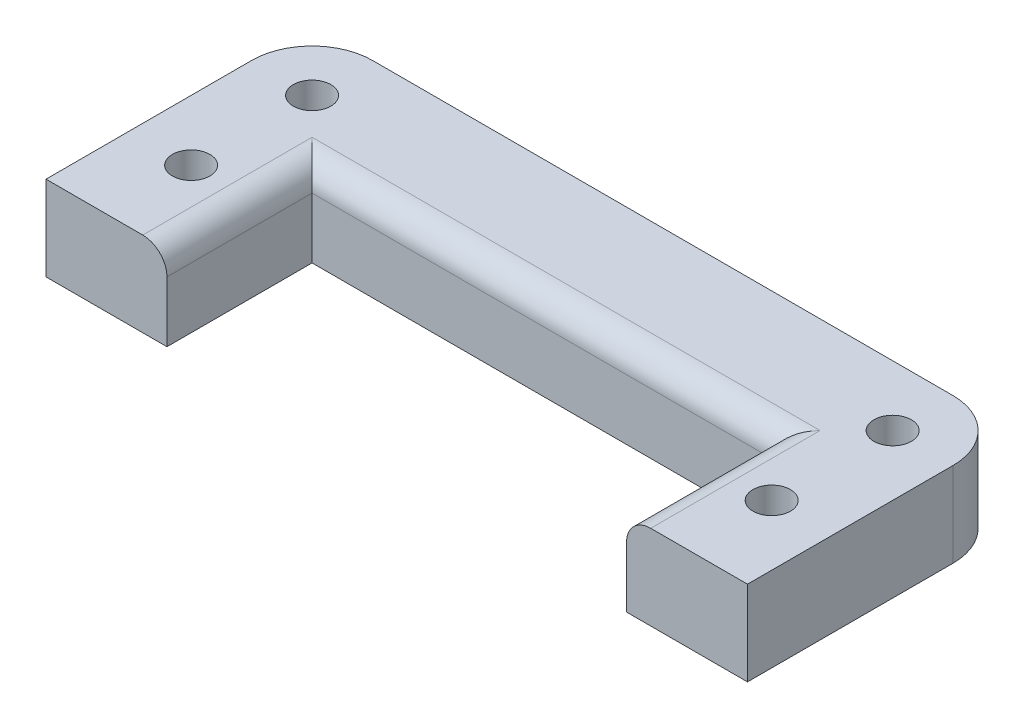
from build123d import *

# Parameters (mm, degrees)
CROQUIS1_R              = 1.55
SALIENTE_EXTRUIR1_DEPTH = 7
REDONDEO2_R             = 2
REDONDEO3_R             = 5


with BuildPart() as part:
    # Croquis1 → Saliente-Extruir1 (new body)
    with BuildSketch(Plane(origin=(0, 0, 0), x_dir=(1, 0, 0), z_dir=(0, 1, 0))):
        Polygon((-29, -7), (-29, 15), (29, 15), (29, -7), (19, -7), (19, 5), (-19, 5), (-19, -7), align=None)
        with Locations(Location((-24, 0, 0), (0, 0, 270))):
            Circle(CROQUIS1_R, mode=Mode.SUBTRACT)
        with Locations(Location((24, 0, 0), (0, 0, 270))):
            Circle(CROQUIS1_R, mode=Mode.SUBTRACT)
        with Locations(Location((-24, 10, 0), (0, 0, 270))):
            Circle(CROQUIS1_R, mode=Mode.SUBTRACT)
        with Locations(Location((24, 10, 0), (0, 0, 270))):
            Circle(CROQUIS1_R, mode=Mode.SUBTRACT)
    extrude(amount=SALIENTE_EXTRUIR1_DEPTH)

    # Redondeo2
    redondeo2_edges = [part.edges().sort_by_distance(p)[0] for p in [
        (0, 7, -5),
        (19, 7, 1),
        (-19, 7, 1),
    ]]
    fillet(redondeo2_edges, radius=REDONDEO2_R)

    # Redondeo3
    redondeo3_edges = [part.edges().sort_by_distance(p)[0] for p in [
        (-29, 3.5, -15),
        (29, 3.5, -15),
    ]]
    fillet(redondeo3_edges, radius=REDONDEO3_R)


solid = part.part
